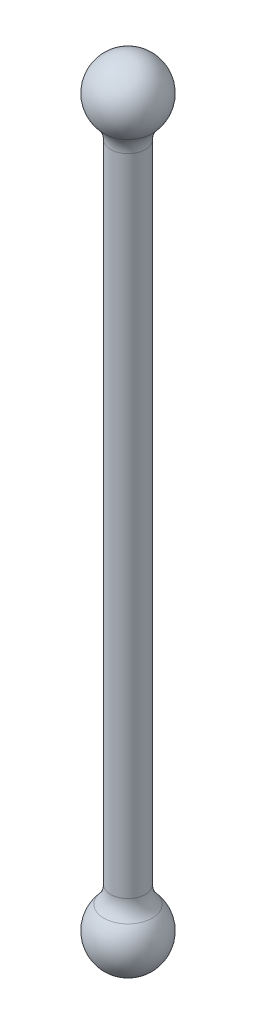
from build123d import *


with BuildPart() as part:
    # Sketch1 → Revolve1 (revolve)
    with BuildSketch(Plane.XY, mode=Mode.PRIVATE) as revolve1_sk:
        with BuildLine():
            Line((0, 6.75), (0, -73.25))
            Line((0, -73.25), (3.5, -73.25))
            Line((3.5, -73.25), (3.5, -8.11249037))
            ThreePointArc((3.5, -8.11249037), (3.858604392, -6.253069275), (4.882978723, -4.660366808))
            ThreePointArc((4.882978723, -4.660366808), (6.205641625, 2.655656609), (0, 6.75))
        make_face()
    revolve1 = revolve(revolve1_sk.sketch.rotate(Axis((0, 6.75, 0), (0, -1, 0)), 180), axis=Axis((0, 6.75, 0), (0, -1, 0)))

    # Mirror1: Revolve1 across plane
    add(revolve1.mirror(Plane.ZX.offset(-73.25)))


solid = part.part
